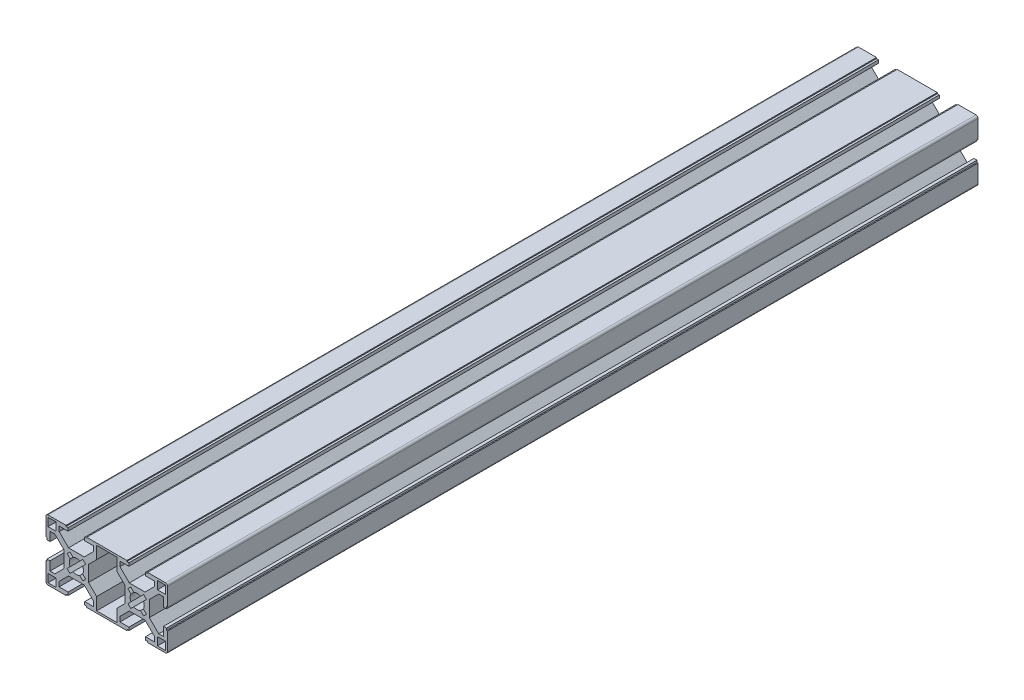
from build123d import *

# Parameters (mm, degrees)
ESBO_O1_W                      = 4
ESBO_O1_H                      = 4
RESSALTO_EXTRUS_O1_DEPTH       = 400
PADR_OCIRCULAR1_COUNT          = 4
PADR_O_LINEAR1_COUNT           = 2
PADR_O_LINEAR1_PITCH           = 30
PADR_O_LINEAR1_COPY_1_SKETCH_W = 4
PADR_O_LINEAR1_COPY_1_SKETCH_H = 4
PADR_O_LINEAR1_COPY_1_DEPTH    = 400
PADR_O_LINEAR1_COPY_2_SKETCH_W = 4
PADR_O_LINEAR1_COPY_2_SKETCH_H = 4
PADR_O_LINEAR1_COPY_2_DEPTH    = 400
PADR_O_LINEAR1_COPY_3_SKETCH_W = 4
PADR_O_LINEAR1_COPY_3_SKETCH_H = 4
PADR_O_LINEAR1_COPY_3_DEPTH    = 400
ESBO_O4_W                      = 10
ESBO_O4_H                      = 28
CORTE_EXTRUS_O1_DEPTH          = 403.802681222
FILETE1_R                      = 1


with BuildPart() as part:
    # Esboço1 → Ressalto-extrusão1 (new body)
    with BuildSketch(Plane.XY):
        with BuildLine():
            ThreePointArc((-1.664601464, 3.078815026), (-0.858529967, 3.393070335), (0, 3.5))
            Line((0, 3.5), (0, 6))
            Line((0, 6), (-3.878679656, 6))
            Line((-3.878679656, 6), (-8.5, 10.621320344))
            Line((-8.5, 10.621320344), (-8.5, 13))
            Line((-8.5, 13), (-4.1, 13))
            Line((-4.1, 13), (-4.1, 14.5))
            Line((-4.1, 14.5), (-5.1, 14.5))
            Line((-5.1, 14.5), (-5.1, 15))
            Line((-5.1, 15), (-15, 15))
            Line((-15, 15), (-15, 5.1))
            Line((-15, 5.1), (-14.5, 5.1))
            Line((-14.5, 5.1), (-14.5, 4.1))
            Line((-14.5, 4.1), (-13, 4.1))
            Line((-13, 4.1), (-13, 8.5))
            Line((-13, 8.5), (-10.621320344, 8.5))
            Line((-10.621320344, 8.5), (-6, 3.878679656))
            Line((-6, 3.878679656), (-6, 0))
            Line((-6, 0), (-3.5, 0))
            ThreePointArc((-3.5, 0), (-3.393070335, 0.858529967), (-3.078815026, 1.664601464))
            Line((-3.078815026, 1.664601464), (-4.596194078, 3.181980515))
            Line((-4.596194078, 3.181980515), (-3.181980515, 4.596194078))
            Line((-3.181980515, 4.596194078), (-1.664601464, 3.078815026))
        make_face()
        with Locations((-12, 12)):
            Rectangle(ESBO_O1_W, ESBO_O1_H, mode=Mode.SUBTRACT)
    ressalto_extrus_o1 = extrude(amount=RESSALTO_EXTRUS_O1_DEPTH)

    # PadrãoCircular1: Ressalto-extrusão1 ×4 about axis
    padr_ocircular1_axis = Axis((0, 0, 0), (0, 0, 1))
    for i in range(1, PADR_OCIRCULAR1_COUNT):
        add(ressalto_extrus_o1.rotate(padr_ocircular1_axis, i * 360 / PADR_OCIRCULAR1_COUNT))

    # Padrão linear1: Ressalto-extrusão1 ×2
    with Locations(*[(i * PADR_O_LINEAR1_PITCH, 0, 0) for i in range(1, PADR_O_LINEAR1_COUNT)]):
        add(ressalto_extrus_o1)

    # Padrão linear1 copy 1 sketch → Padrão linear1 copy 1 (add)
    with BuildSketch(Plane(origin=(30, 0, 0), x_dir=(0, 1, 0), z_dir=(0, 0, 1))):
        with BuildLine():
            ThreePointArc((-1.664601464, 3.078815026), (-0.858529967, 3.393070335), (0, 3.5))
            Line((0, 3.5), (0, 6))
            Line((0, 6), (-3.878679656, 6))
            Line((-3.878679656, 6), (-8.5, 10.621320344))
            Line((-8.5, 10.621320344), (-8.5, 13))
            Line((-8.5, 13), (-4.1, 13))
            Line((-4.1, 13), (-4.1, 14.5))
            Line((-4.1, 14.5), (-5.1, 14.5))
            Line((-5.1, 14.5), (-5.1, 15))
            Line((-5.1, 15), (-15, 15))
            Line((-15, 15), (-15, 5.1))
            Line((-15, 5.1), (-14.5, 5.1))
            Line((-14.5, 5.1), (-14.5, 4.1))
            Line((-14.5, 4.1), (-13, 4.1))
            Line((-13, 4.1), (-13, 8.5))
            Line((-13, 8.5), (-10.621320344, 8.5))
            Line((-10.621320344, 8.5), (-6, 3.878679656))
            Line((-6, 3.878679656), (-6, 0))
            Line((-6, 0), (-3.5, 0))
            ThreePointArc((-3.5, 0), (-3.393070335, 0.858529967), (-3.078815026, 1.664601464))
            Line((-3.078815026, 1.664601464), (-4.596194078, 3.181980515))
            Line((-4.596194078, 3.181980515), (-3.181980515, 4.596194078))
            Line((-3.181980515, 4.596194078), (-1.664601464, 3.078815026))
        make_face()
        with Locations((-12, 12)):
            Rectangle(PADR_O_LINEAR1_COPY_1_SKETCH_W, PADR_O_LINEAR1_COPY_1_SKETCH_H, mode=Mode.SUBTRACT)
    extrude(amount=PADR_O_LINEAR1_COPY_1_DEPTH)

    # Padrão linear1 copy 2 sketch → Padrão linear1 copy 2 (add)
    with BuildSketch(Plane(origin=(30, 0, 0), x_dir=(-1, 0, 0), z_dir=(0, 0, 1))):
        with BuildLine():
            ThreePointArc((-1.664601464, 3.078815026), (-0.858529967, 3.393070335), (0, 3.5))
            Line((0, 3.5), (0, 6))
            Line((0, 6), (-3.878679656, 6))
            Line((-3.878679656, 6), (-8.5, 10.621320344))
            Line((-8.5, 10.621320344), (-8.5, 13))
            Line((-8.5, 13), (-4.1, 13))
            Line((-4.1, 13), (-4.1, 14.5))
            Line((-4.1, 14.5), (-5.1, 14.5))
            Line((-5.1, 14.5), (-5.1, 15))
            Line((-5.1, 15), (-15, 15))
            Line((-15, 15), (-15, 5.1))
            Line((-15, 5.1), (-14.5, 5.1))
            Line((-14.5, 5.1), (-14.5, 4.1))
            Line((-14.5, 4.1), (-13, 4.1))
            Line((-13, 4.1), (-13, 8.5))
            Line((-13, 8.5), (-10.621320344, 8.5))
            Line((-10.621320344, 8.5), (-6, 3.878679656))
            Line((-6, 3.878679656), (-6, 0))
            Line((-6, 0), (-3.5, 0))
            ThreePointArc((-3.5, 0), (-3.393070335, 0.858529967), (-3.078815026, 1.664601464))
            Line((-3.078815026, 1.664601464), (-4.596194078, 3.181980515))
            Line((-4.596194078, 3.181980515), (-3.181980515, 4.596194078))
            Line((-3.181980515, 4.596194078), (-1.664601464, 3.078815026))
        make_face()
        with Locations((-12, 12)):
            Rectangle(PADR_O_LINEAR1_COPY_2_SKETCH_W, PADR_O_LINEAR1_COPY_2_SKETCH_H, mode=Mode.SUBTRACT)
    extrude(amount=PADR_O_LINEAR1_COPY_2_DEPTH)

    # Padrão linear1 copy 3 sketch → Padrão linear1 copy 3 (add)
    with BuildSketch(Plane(origin=(30, 0, 0), x_dir=(0, -1, 0), z_dir=(0, 0, 1))):
        with BuildLine():
            ThreePointArc((-1.664601464, 3.078815026), (-0.858529967, 3.393070335), (0, 3.5))
            Line((0, 3.5), (0, 6))
            Line((0, 6), (-3.878679656, 6))
            Line((-3.878679656, 6), (-8.5, 10.621320344))
            Line((-8.5, 10.621320344), (-8.5, 13))
            Line((-8.5, 13), (-4.1, 13))
            Line((-4.1, 13), (-4.1, 14.5))
            Line((-4.1, 14.5), (-5.1, 14.5))
            Line((-5.1, 14.5), (-5.1, 15))
            Line((-5.1, 15), (-15, 15))
            Line((-15, 15), (-15, 5.1))
            Line((-15, 5.1), (-14.5, 5.1))
            Line((-14.5, 5.1), (-14.5, 4.1))
            Line((-14.5, 4.1), (-13, 4.1))
            Line((-13, 4.1), (-13, 8.5))
            Line((-13, 8.5), (-10.621320344, 8.5))
            Line((-10.621320344, 8.5), (-6, 3.878679656))
            Line((-6, 3.878679656), (-6, 0))
            Line((-6, 0), (-3.5, 0))
            ThreePointArc((-3.5, 0), (-3.393070335, 0.858529967), (-3.078815026, 1.664601464))
            Line((-3.078815026, 1.664601464), (-4.596194078, 3.181980515))
            Line((-4.596194078, 3.181980515), (-3.181980515, 4.596194078))
            Line((-3.181980515, 4.596194078), (-1.664601464, 3.078815026))
        make_face()
        with Locations((-12, 12)):
            Rectangle(PADR_O_LINEAR1_COPY_3_SKETCH_W, PADR_O_LINEAR1_COPY_3_SKETCH_H, mode=Mode.SUBTRACT)
    extrude(amount=PADR_O_LINEAR1_COPY_3_DEPTH)

    # Esboço4 → Corte-extrusão1 (cut, through all)
    with BuildSketch(Plane(origin=(0, 0, 0), x_dir=(-1, 0, 0), z_dir=(0, 0, -1))):
        with Locations((-15, 0)):
            Rectangle(ESBO_O4_W, ESBO_O4_H)
    extrude(amount=-CORTE_EXTRUS_O1_DEPTH, mode=Mode.SUBTRACT)

    # Filete1
    filete1_edges = [part.edges().sort_by_distance(p)[0] for p in [
        (45, -15, 200),
        (45, 15, 200),
        (-15, 15, 200),
        (-15, -15, 200),
    ]]
    fillet(filete1_edges, radius=FILETE1_R)


solid = part.part
